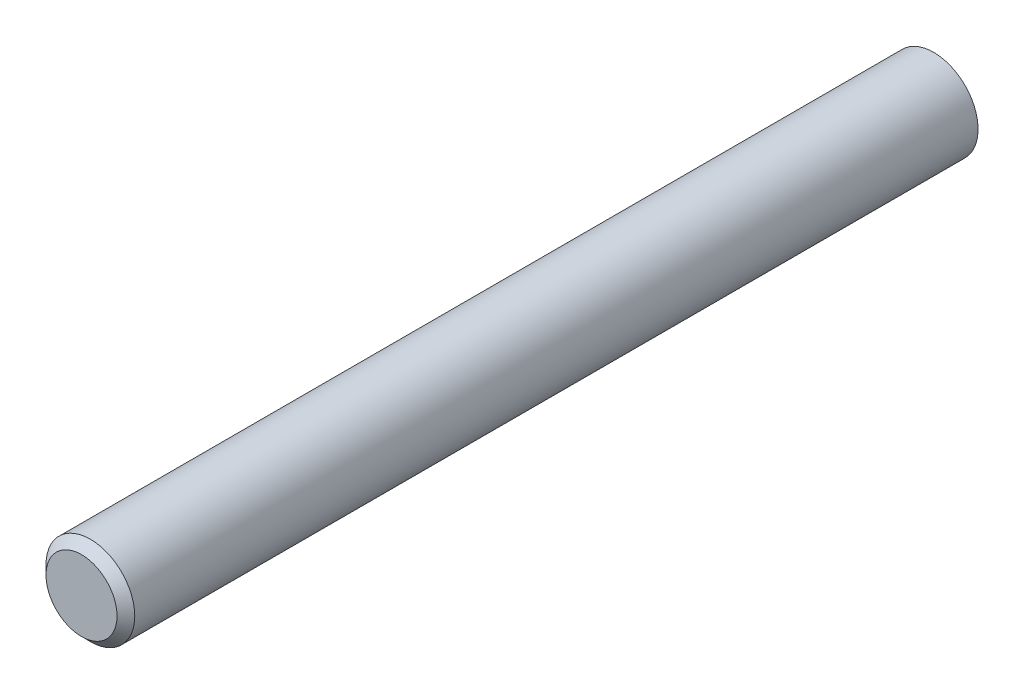
from build123d import *

# Parameters (mm, degrees)
SKETCH3_R           = 3.96875
BOSS_EXTRUDE1_DEPTH = 50.8
CHAMFER1_SIZE       = 0.79375
CUT_EXTRUDE2_START  = -25.4
SKETCH5_R           = 3.96875
CUT_EXTRUDE2_DEPTH  = 25.4


with BuildPart() as part:
    # Sketch3 → Boss-Extrude1 (new, symmetric)
    with BuildSketch(Plane.XY):
        Circle(SKETCH3_R)
    extrude(amount=BOSS_EXTRUDE1_DEPTH, both=True)

    # Chamfer1
    chamfer1_edges = [part.edges().sort_by_distance(p)[0] for p in [
        (-3.96875, 0, -50.8),
        (-3.96875, 0, 50.8),
    ]]
    chamfer(chamfer1_edges, length=CHAMFER1_SIZE)

    # Sketch5 → Cut-Extrude2 (cut)
    with BuildSketch(Plane(origin=(0, 0, -50.8), x_dir=(-1, 0, 0), z_dir=(0, 0, -1)).offset(CUT_EXTRUDE2_START)):
        Circle(SKETCH5_R)
    extrude(amount=CUT_EXTRUDE2_DEPTH, mode=Mode.SUBTRACT)


solid = part.part
